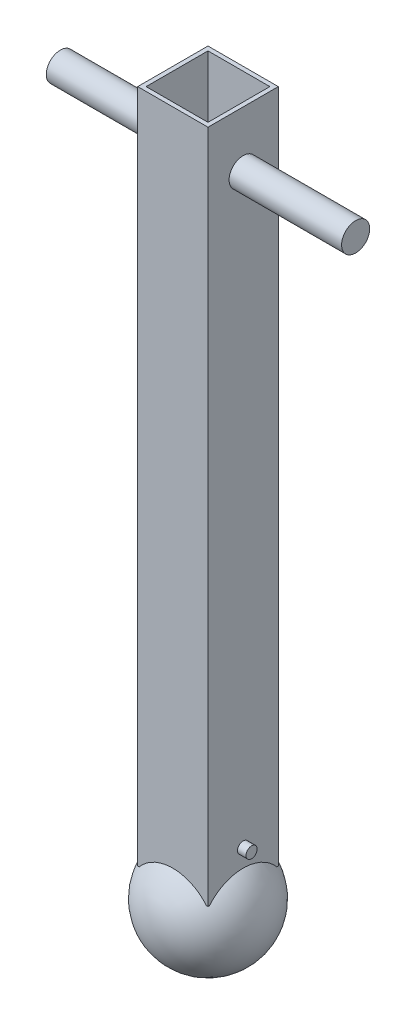
from build123d import *

# Parameters (mm, degrees)
SKETCH1_W                 = 25
SKETCH1_H                 = 25
BOSS_EXTRUDE1_DEPTH       = 240
SKETCH3_W                 = 22
SKETCH3_H                 = 22
CUT_EXTRUDE1_DEPTH        = 300
SKETCH6_R                 = 2
CUT_EXTRUDE3_DEPTH        = 25
SKETCH9_R                 = 1.99
BOSS_EXTRUDE8_DEPTH       = 28
SKETCH10_R                = 1.99
BOSS_EXTRUDE9_DEPTH       = 3
BOSS_EXTRUDE11_DEPTH      = 52.5
BOSS_EXTRUDE11_DEPTH_BACK = 52.5
SKETCH13_R                = 5


with BuildPart() as part:
    # Sketch1 → Boss-Extrude1 (new body)
    with BuildSketch(Plane(origin=(0, 0, 0), x_dir=(1, 0, 0), z_dir=(0, 1, 0))):
        Rectangle(SKETCH1_W, SKETCH1_H)
    extrude(amount=BOSS_EXTRUDE1_DEPTH)

    # Sketch3 → Cut-Extrude1 (cut)
    with BuildSketch(Plane.XZ):
        Rectangle(SKETCH3_W, SKETCH3_H)
    extrude(amount=-CUT_EXTRUDE1_DEPTH, mode=Mode.SUBTRACT)

    # Sketch4 → Revolve1 (revolve)
    with BuildSketch(Plane(origin=(0, -10, 0), x_dir=(-1, 0, 0), z_dir=(0, -1, 0))):
        with BuildLine():
            Line((0, 20), (0, -20))
            ThreePointArc((0, -20), (-20, 0), (0, 20))
        make_face()
    revolve(axis=Axis((0, -10, -13.212098256), (0, 0, 1)))

    # Sketch6 → Cut-Extrude3 (cut)
    with BuildSketch(Plane(origin=(12.5, 0, 0), x_dir=(0, 0, -1), z_dir=(1, 0, 0))):
        with Locations((0, 12)):
            Circle(SKETCH6_R)
    extrude(amount=-CUT_EXTRUDE3_DEPTH, mode=Mode.SUBTRACT)

    # Sketch13 → Boss-Extrude11 (add, two sides: drawn at the far end of the back side and taken through both)
    with BuildSketch(Plane(origin=(0, 0, 0), x_dir=(0, 0, -1), z_dir=(1, 0, 0)).offset(-BOSS_EXTRUDE11_DEPTH_BACK)):
        with Locations((0, 220)):
            Circle(SKETCH13_R)
    extrude(amount=BOSS_EXTRUDE11_DEPTH + BOSS_EXTRUDE11_DEPTH_BACK)


with BuildPart() as body_2:
    # Sketch9 → Boss-Extrude8 (new body)
    with BuildSketch(Plane.ZY.offset(12.5)):
        with Locations((0, 12)):
            Circle(SKETCH9_R)
    extrude(amount=-BOSS_EXTRUDE8_DEPTH)

    # Sketch10 → Boss-Extrude9 (add)
    with BuildSketch(Plane.ZY.offset(12.5)):
        with Locations((0, 12)):
            Circle(SKETCH10_R)
    extrude(amount=BOSS_EXTRUDE9_DEPTH)


solid = Compound([part.part, body_2.part])
